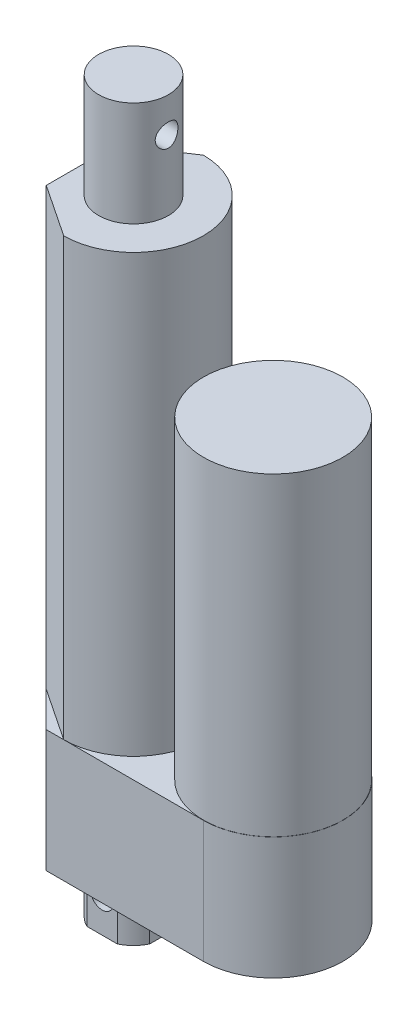
from build123d import *

# Parameters (mm, degrees)
EXTRUDE_1_DEPTH     = 35
EXTRUDE_3_DEPTH     = 125
SKETCH_3_R          = 19.95
EXTRUDE_5_DEPTH     = 90
SKETCH_4_R          = 10
EXTRUDE_6_DEPTH     = 30
SKETCH_5_R          = 3.25
CUT_EXTRUDE_1_DEPTH = 30
EXTRUDE_START       = 19
EXTRUDE_7_DEPTH     = 19
CUT_EXTRUDE_2_REACH = 199.983
SKETCH_7_R          = 3.25


with BuildPart() as part:
    # 草图1 → 凸台-拉伸1 (new body)
    with BuildSketch(Plane(origin=(0, 0, 0), x_dir=(1, 0, 0), z_dir=(0, 1, 0))):
        with BuildLine():
            Line((-27.5, 10), (-17.5, 20))
            Line((-17.5, 20), (27.5, 20))
            ThreePointArc((27.5, 20), (47.5, 0), (27.5, -20))
            Line((27.5, -20), (-17.5, -20))
            Line((-17.5, -20), (-27.5, -10))
            Line((-27.5, -10), (-27.5, 10))
        make_face()
    extrude(amount=EXTRUDE_1_DEPTH)

    # 草图2 → 凸台-拉伸3 (add)
    with BuildSketch(Plane(origin=(0, 35, 0), x_dir=(1, 0, 0), z_dir=(0, 1, 0))):
        with BuildLine():
            Line((-12.5, 20), (-27.5, 10))
            Line((-27.5, 10), (-27.5, -10))
            Line((-27.5, -10), (-12.5, -20))
            ThreePointArc((-12.5, -20), (7.5, 0), (-12.5, 20))
        make_face()
    extrude(amount=EXTRUDE_3_DEPTH)

    # 草图3 → 凸台-拉伸5 (add)
    with BuildSketch(Plane(origin=(0, 35, 0), x_dir=(1, 0, 0), z_dir=(0, 1, 0))):
        with Locations((27.5, 0)):
            Circle(SKETCH_3_R)
    extrude(amount=EXTRUDE_5_DEPTH)

    # 草图4 → 凸台-拉伸6 (add)
    with BuildSketch(Plane(origin=(0, 160, 0), x_dir=(1, 0, 0), z_dir=(0, 1, 0))):
        with Locations((-12.5, 0)):
            Circle(SKETCH_4_R)
    extrude(amount=EXTRUDE_6_DEPTH)

    # 草图5 → 切除-拉伸1 (cut)
    with BuildSketch(Plane(origin=(-27.5, 0, -27.5), x_dir=(0, 0, -1), z_dir=(1, 0, 0))):
        with Locations((-27.5, 180)):
            Circle(SKETCH_5_R)
    extrude(amount=CUT_EXTRUDE_1_DEPTH, mode=Mode.SUBTRACT)

    # 草图6 → 凸台-拉伸7 (add)
    with BuildSketch(Plane.XZ.offset(EXTRUDE_START)):
        with BuildLine():
            Line((-16.858898944, -9), (-8.141101056, -9))
            ThreePointArc((-8.141101056, -9), (-5.428932188, -7.071067812), (-3.5, -4.358898944))
            Line((-3.5, -4.358898944), (-3.5, 4.358898944))
            ThreePointArc((-3.5, 4.358898944), (-5.428932188, 7.071067812), (-8.141101056, 9))
            Line((-8.141101056, 9), (-16.858898944, 9))
            ThreePointArc((-16.858898944, 9), (-19.571067812, 7.071067812), (-21.5, 4.358898944))
            Line((-21.5, 4.358898944), (-21.5, -4.358898944))
            ThreePointArc((-21.5, -4.358898944), (-19.571067812, -7.071067812), (-16.858898944, -9))
        make_face()
    extrude(amount=-EXTRUDE_7_DEPTH)

    # 草图7 → 切除-拉伸2 (cut, up to next)
    with BuildSketch(Plane.XY.offset(9), mode=Mode.PRIVATE) as cut_extrude_2_sk1:
        with Locations((-12.5, -9.5)):
            Circle(SKETCH_7_R)
    cut_extrude_2_tool1 = extrude(cut_extrude_2_sk1.sketch, amount=-CUT_EXTRUDE_2_REACH, mode=Mode.PRIVATE) & part.part
    add(cut_extrude_2_tool1.solids().sort_by_distance((-12.5, -9.5, 9))[0], mode=Mode.SUBTRACT)


solid = part.part
